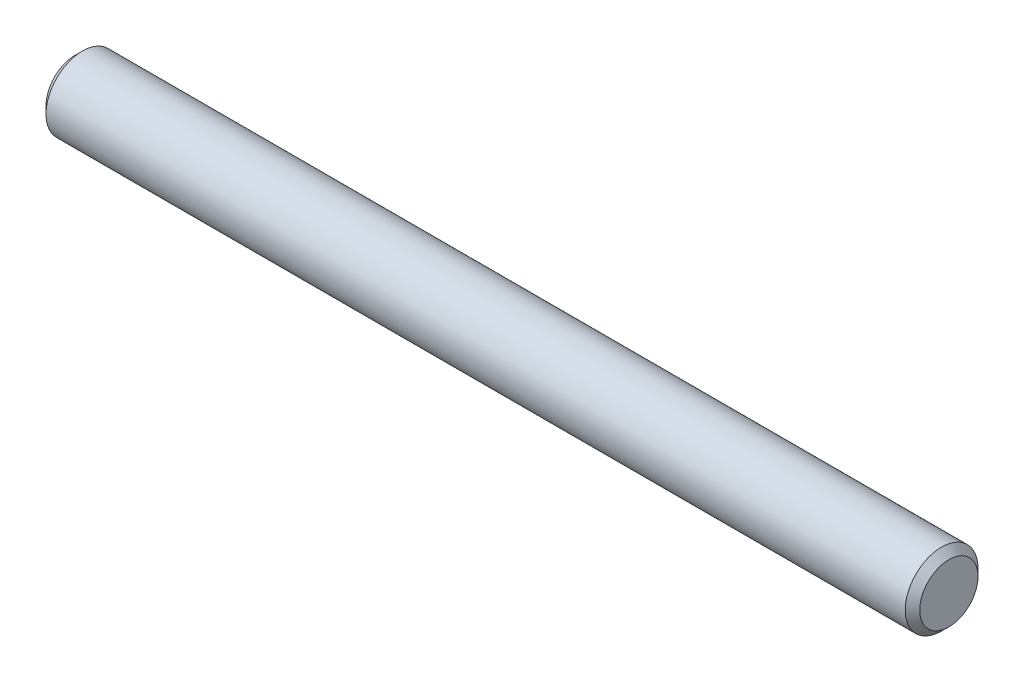
from build123d import *

# Parameters (mm, degrees)
EXTRUDE1_DEPTH      = 38.1
EXTRUDE1_DEPTH_BACK = 38.1
SKETCH2_R           = 3.175
CHAMFER1_SIZE       = 0.635


with BuildPart() as part:
    # Sketch2 → Extrude1 (new, two sides: drawn at the far end of the back side and taken through both)
    with BuildSketch(Plane(origin=(0, 0, 0), x_dir=(0, 0, -1), z_dir=(1, 0, 0)).offset(-EXTRUDE1_DEPTH_BACK)):
        Circle(SKETCH2_R)
    extrude(amount=EXTRUDE1_DEPTH + EXTRUDE1_DEPTH_BACK)

    # Chamfer1
    chamfer1_edges = [part.edges().sort_by_distance(p)[0] for p in [
        (-38.1, 0, 3.175),
        (38.1, 0, 3.175),
    ]]
    chamfer(chamfer1_edges, length=CHAMFER1_SIZE)


solid = part.part
